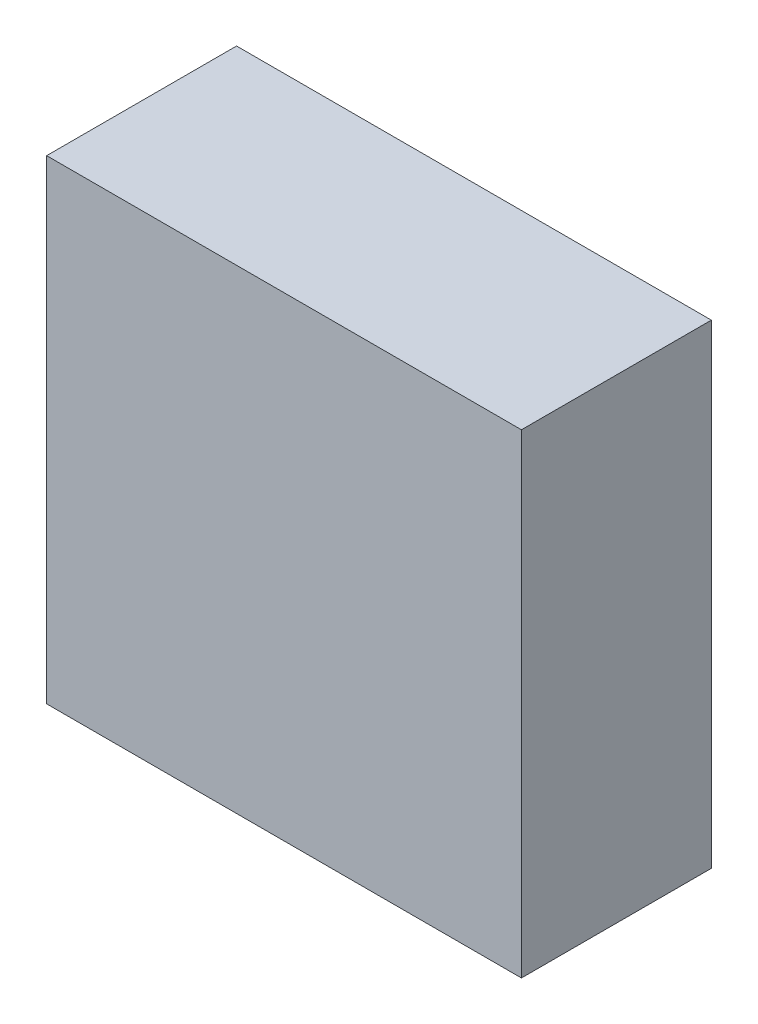
from build123d import *

# Parameters (mm, degrees)
SKIZZE1_W                       = 2
SKIZZE1_H                       = 2
AUFSATZ_LINEAR_AUSTRAGEN1_DEPTH = 0.8


with BuildPart() as part:
    # Skizze1 → Aufsatz-Linear austragen1 (new body)
    with BuildSketch(Plane.XY):
        Rectangle(SKIZZE1_W, SKIZZE1_H)
    extrude(amount=AUFSATZ_LINEAR_AUSTRAGEN1_DEPTH)


solid = part.part
